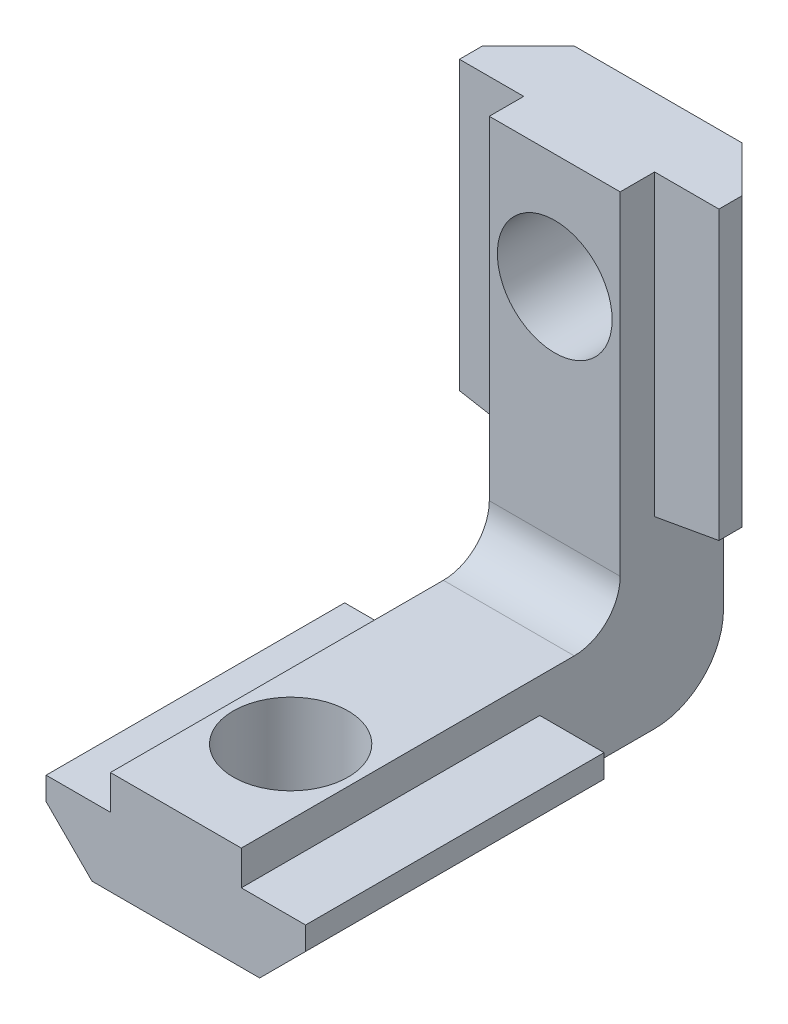
from build123d import *

# Parameters (mm, degrees)
BOSS_EXTRUDE1_DEPTH      = 13
SKETCH2_R                = 2.5
CUT_EXTRUDE1_DEPTH       = 23.207487476
BOSS_EXTRUDE2_DEPTH      = 13
CUT_EXTRUDE2_DEPTH       = 28.297847901
BOSS_EXTRUDE3_DEPTH      = 2.85
BOSS_EXTRUDE3_DEPTH_BACK = 2.85
SKETCH5_W                = 4.5
SKETCH5_H                = 2.5


with BuildPart() as part:
    # Sketch1 → Boss-Extrude1 (new body)
    with BuildSketch(Plane.XY.offset(21)):
        Polygon((-2.85, 4.5), (2.85, 4.5), (2.85, 3), (5.65, 3), (5.65, 2), (3.65, 0), (-3.65, 0), (-5.65, 2), (-5.65, 3), (-2.85, 3), align=None)
    extrude(amount=-BOSS_EXTRUDE1_DEPTH)

    # Sketch2 → Cut-Extrude1 (cut, through all)
    with BuildSketch(Plane(origin=(0, 4.5, 0), x_dir=(1, 0, 0), z_dir=(0, 1, 0))):
        with Locations(Location((0, -16, 0), (0, 0, 180))):
            Circle(SKETCH2_R)
    extrude(amount=-CUT_EXTRUDE1_DEPTH, mode=Mode.SUBTRACT)



with BuildPart() as body_2:
    # Sketch3 → Boss-Extrude2 (new body)
    with BuildSketch(Plane(origin=(0, 21, 0), x_dir=(-1, 0, 0), z_dir=(0, 1, 0))):
        Polygon((2.85, 4.5), (-2.85, 4.5), (-2.85, 3), (-5.65, 3), (-5.65, 2), (-3.65, 0), (3.65, 0), (5.65, 2), (5.65, 3), (2.85, 3), align=None)
    extrude(amount=-BOSS_EXTRUDE2_DEPTH)

    # Sketch6 → Cut-Extrude2 (cut, through all)
    with BuildSketch(Plane.XY.offset(4.5)):
        Polygon((-5.65, 8), (-5.65, 8.5), (-2.85, 8), align=None)
        Polygon((2.85, 8), (5.65, 8), (5.65, 8.5), align=None)
    extrude(amount=-CUT_EXTRUDE2_DEPTH, mode=Mode.SUBTRACT)


with BuildPart() as part_1:
    add(part.part)

    add(body_2.part)  # Boss-Extrude3 merges body 2
    # Sketch7 → Boss-Extrude3 (add, two sides: drawn at the far end of the back side and taken through both)
    with BuildSketch(Plane(origin=(0, 0, 0), x_dir=(0, 0, -1), z_dir=(1, 0, 0)).offset(-BOSS_EXTRUDE3_DEPTH_BACK)):
        with BuildLine():
            Line((-8, 0), (-3, 0))
            ThreePointArc((-3, 0), (-0.878679656, 0.878679656), (0, 3))
            Line((0, 3), (0, 8))
            Line((0, 8), (-4.5, 8))
            Line((-4.5, 8), (-4.5, 6.5))
            ThreePointArc((-4.5, 6.5), (-5.085786438, 5.085786438), (-6.5, 4.5))
            Line((-6.5, 4.5), (-8, 4.5))
            Line((-8, 4.5), (-8, 0))
        make_face()
    extrude(amount=BOSS_EXTRUDE3_DEPTH + BOSS_EXTRUDE3_DEPTH_BACK)

    # Sketch5 → Cut-Revolve1 (revolve, cut)
    with BuildSketch(Plane(origin=(0, 0, 0), x_dir=(0, 0, -1), z_dir=(1, 0, 0)), mode=Mode.PRIVATE) as cut_revolve1_sk:
        with Locations((-2.25, 17.25)):
            Rectangle(SKETCH5_W, SKETCH5_H)
    revolve(cut_revolve1_sk.sketch.rotate(Axis((0, 16, 6.063446942), (0, 0, -1)), 90), axis=Axis((0, 16, 6.063446942), (0, 0, -1)), mode=Mode.SUBTRACT)


solid = part_1.part
